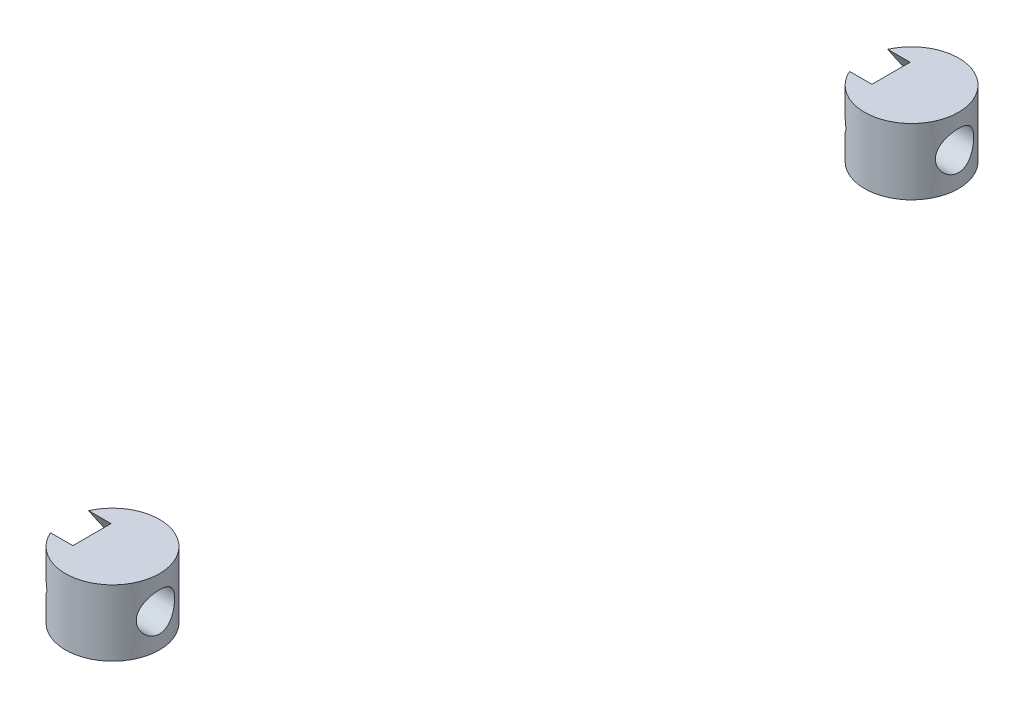
from build123d import *

# Parameters (mm, degrees)
SKETCH1_R               = 9.025
BOSS_EXTRUDE1_DEPTH     = 12.7
BOSS_EXTRUDE1_2_DEPTH   = 12.7
CUT_EXTRUDE1_DEPTH      = 88.129307641
CUT_EXTRUDE1_DEPTH_BACK = 88.129307641
SKETCH2_R               = 3.675
CUT_EXTRUDE2_DEPTH      = 5.08


with BuildPart() as part:
    # Sketch1 → Boss-Extrude1 (new body)
    with BuildSketch(Plane(origin=(0, 0, 0), x_dir=(1, 0, 0), z_dir=(0, 1, 0))):
        with Locations(Location((0, 76.7, 0), (0, 0, 270))):
            Circle(SKETCH1_R)
    extrude(amount=BOSS_EXTRUDE1_DEPTH)


with BuildPart() as body_2:
    # Sketch1 → Boss-Extrude1 2 (new body)
    with BuildSketch(Plane(origin=(0, 0, 0), x_dir=(1, 0, 0), z_dir=(0, 1, 0))):
        with Locations(Location((0, -76.7, 0), (0, 0, 270))):
            Circle(SKETCH1_R)
    extrude(amount=BOSS_EXTRUDE1_2_DEPTH)


with BuildPart() as cut_extrude1_tool:
    # Sketch2 → Cut-Extrude1 (new, two sides: drawn at the far end of the back side and taken through both)
    with BuildSketch(Plane(origin=(0, 0, 0), x_dir=(0, 0, -1), z_dir=(1, 0, 0)).offset(-CUT_EXTRUDE1_DEPTH_BACK)):
        with Locations((-76.7, 6.35)):
            Circle(SKETCH2_R)
        with Locations((76.7, 6.35)):
            Circle(SKETCH2_R)
    extrude(amount=CUT_EXTRUDE1_DEPTH + CUT_EXTRUDE1_DEPTH_BACK)


with BuildPart() as part_1:
    add(part.part)

    # Cut-Extrude1: cut by cut_extrude1_tool
    add(cut_extrude1_tool.part, mode=Mode.SUBTRACT)


with BuildPart() as body_2_1:
    add(body_2.part)

    # Cut-Extrude1: cut by cut_extrude1_tool
    add(cut_extrude1_tool.part, mode=Mode.SUBTRACT)


with BuildPart() as cut_extrude2_tool:
    # Sketch3 → Cut-Extrude2 (new body)
    with BuildSketch(Plane.ZY.offset(9.025)):
        Polygon((80.366174209, 0), (84.032348419, 6.35), (80.366174209, 12.7), (73.033825791, 12.7), (69.367651581, 6.35), (73.033825791, 0), align=None)
        Polygon((-73.033825791, 0), (-80.366174209, 0), (-84.032348419, 6.35), (-80.366174209, 12.7), (-73.033825791, 12.7), (-69.367651581, 6.35), align=None)
    extrude(amount=-CUT_EXTRUDE2_DEPTH)


with BuildPart() as part_2:
    add(part_1.part)

    # Cut-Extrude2: cut by cut_extrude2_tool
    add(cut_extrude2_tool.part, mode=Mode.SUBTRACT)


with BuildPart() as body_2_2:
    add(body_2_1.part)

    # Cut-Extrude2: cut by cut_extrude2_tool
    add(cut_extrude2_tool.part, mode=Mode.SUBTRACT)


solid = Compound([part_2.part, body_2_2.part])
